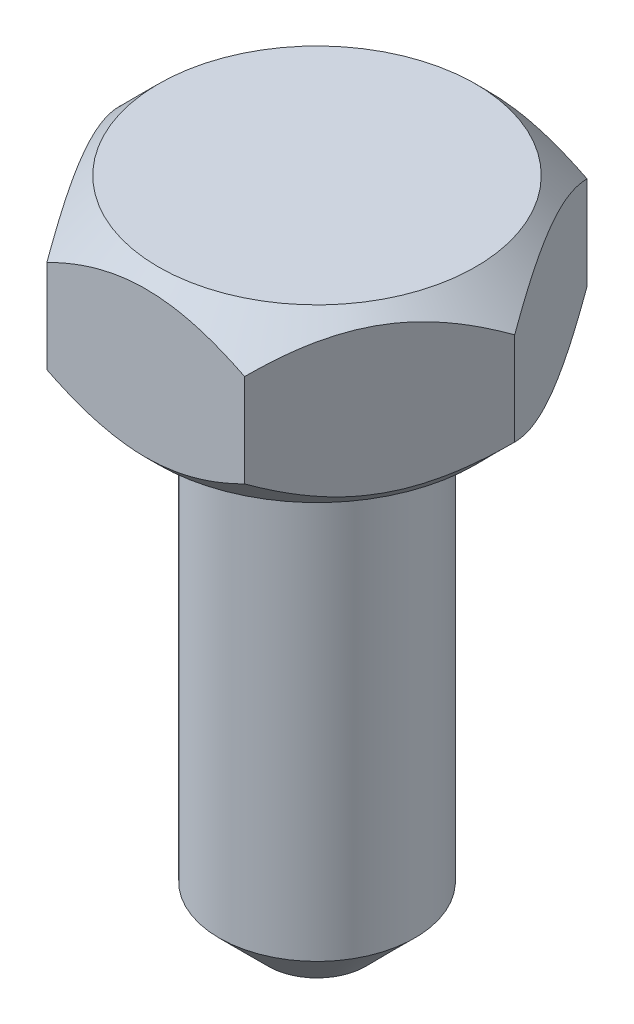
from build123d import *

# Parameters (mm, degrees)
EXTRUDE_1_DEPTH = 3.5
SKETCH_5_R      = 2
EXTRUDE_2_DEPTH = 10
CHAMFER_1_SIZE  = 1


with BuildPart() as part:
    # Эскиз1 → Вытянуть1 (new body)
    with BuildSketch(Plane(origin=(0, 0, 0), x_dir=(1, 0, 0), z_dir=(0, 1, 0))):
        Polygon((-2.020725942, 3.5), (2.020725942, 3.5), (4.041451884, 0), (2.020725942, -3.5), (-2.020725942, -3.5), (-4.041451884, 0), align=None)
    extrude(amount=-EXTRUDE_1_DEPTH)

    # Эскиз5 → Вытянуть2 (add)
    with BuildSketch(Plane.XZ.offset(3.5)):
        with Locations(Location((0, 0, 0), (0, 0, 90))):
            Circle(SKETCH_5_R)
    extrude(amount=EXTRUDE_2_DEPTH)

    # Фаска1
    chamfer_1_edges = [part.edges().sort_by_distance(p)[0] for p in [
        (0, -13.5, -2),
    ]]
    chamfer(chamfer_1_edges, length=CHAMFER_1_SIZE)

    # Эскиз4 → Вырез-Повернуть1 (revolve, cut)
    with BuildSketch(Plane.XY, mode=Mode.PRIVATE) as cut_revolve_1_sk:
        Polygon((-4.041451884, -0.8), (-3.241451884, 0), (-4.041451884, 0), align=None)
        Polygon((-4.041451884, -2.7), (-3.241451884, -3.5), (-4.041451884, -3.5), align=None)
    revolve(cut_revolve_1_sk.sketch.rotate(Axis((0, -3.5, 0), (0, -1, 0)), 120.000000136), axis=Axis((0, -3.5, 0), (0, -1, 0)), mode=Mode.SUBTRACT)


solid = part.part
